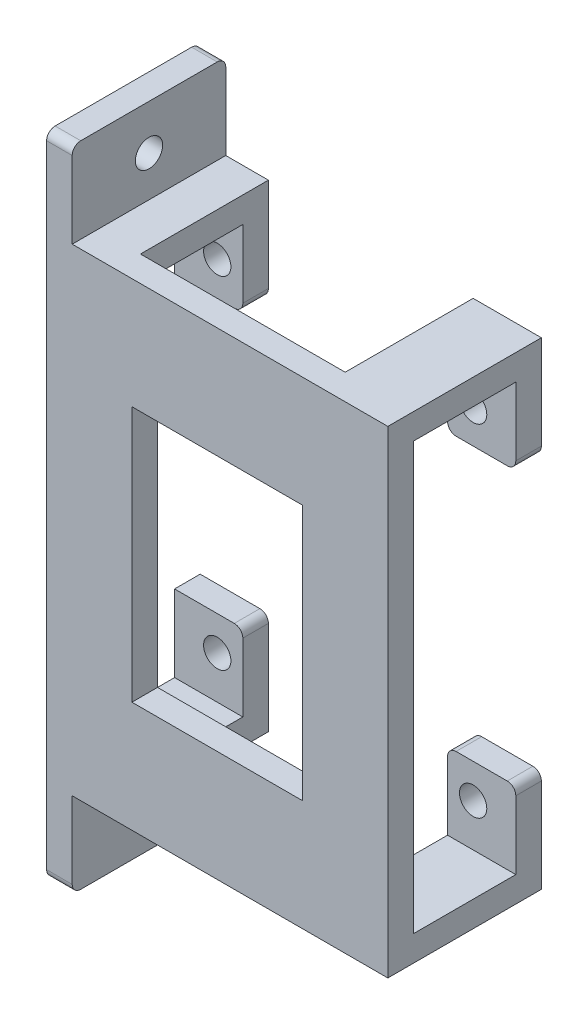
from build123d import *

# Parameters (mm, degrees)
SKETCH_1_W          = 40
SKETCH_1_H          = 50
SKETCH_1_R          = 1.6
EXTRUDE_1_DEPTH     = 3
SKETCH_2_W          = 8
SKETCH_2_H          = 3
EXTRUDE_2_DEPTH     = 15
SKETCH_3_W          = 40
SKETCH_3_H          = 56
EXTRUDE_3_DEPTH     = 3
CUT_EXTRUDE_1_REACH = 40.833
SKETCH_4_W          = 40
SKETCH_4_H          = 32
CUT_EXTRUDE_START   = -3
SKETCH_5_W          = 24
SKETCH_5_H          = 50
CUT_EXTRUDE_2_DEPTH = 3
FILLET_1_R          = 1
CUT_EXTRUDE_4_REACH = 39.537
SKETCH_10_W         = 20
SKETCH_10_H         = 30
SKETCH_11_W         = 3
SKETCH_11_H         = 18
EXTRUDE_4_DEPTH     = 10
CUT_EXTRUDE_5_REACH = 58.009
SKETCH_12_R         = 1.6
FILLET_2_R          = 1


with BuildPart() as part:
    # 草图1 → 凸台-拉伸1 (new body)
    with BuildSketch(Plane.XY):
        Rectangle(SKETCH_1_W, SKETCH_1_H)
        with Locations((-15, 20)):
            Circle(SKETCH_1_R, mode=Mode.SUBTRACT)
        with Locations((15, 20)):
            Circle(SKETCH_1_R, mode=Mode.SUBTRACT)
        with Locations((15, -20)):
            Circle(SKETCH_1_R, mode=Mode.SUBTRACT)
        with Locations((-15, -20)):
            Circle(SKETCH_1_R, mode=Mode.SUBTRACT)
    extrude(amount=EXTRUDE_1_DEPTH)

    # 草图2 → 凸台-拉伸2 (add)
    with BuildSketch(Plane(origin=(0, 0, 0), x_dir=(-1, 0, 0), z_dir=(0, 0, -1))):
        with Locations((-16, 26.5)):
            Rectangle(SKETCH_2_W, SKETCH_2_H)
        with Locations((16, 26.5)):
            Rectangle(SKETCH_2_W, SKETCH_2_H)
        with Locations((-16, -26.5)):
            Rectangle(SKETCH_2_W, SKETCH_2_H)
        with Locations((16, -26.5)):
            Rectangle(SKETCH_2_W, SKETCH_2_H)
    extrude(amount=-EXTRUDE_2_DEPTH)

    # 草图3 → 凸台-拉伸3 (add)
    with BuildSketch(Plane.XY.offset(15)):
        Rectangle(SKETCH_3_W, SKETCH_3_H)
    extrude(amount=EXTRUDE_3_DEPTH)

    # 草图4 → 切除-拉伸1 (cut, up to next)
    with BuildSketch(Plane(origin=(0, 0, 0), x_dir=(-1, 0, 0), z_dir=(0, 0, -1)), mode=Mode.PRIVATE) as cut_extrude_1_sk1:
        Rectangle(SKETCH_4_W, SKETCH_4_H)
    cut_extrude_1_tool1 = extrude(cut_extrude_1_sk1.sketch, amount=-CUT_EXTRUDE_1_REACH, mode=Mode.PRIVATE) & part.part
    add(cut_extrude_1_tool1.solids().sort_by_distance((0, 0, 0))[0], mode=Mode.SUBTRACT)

    # 草图5 → 切除-拉伸2 (cut)
    with BuildSketch(Plane(origin=(0, 0, 0), x_dir=(-1, 0, 0), z_dir=(0, 0, -1)).offset(CUT_EXTRUDE_START)):
        Rectangle(SKETCH_5_W, SKETCH_5_H)
    extrude(amount=CUT_EXTRUDE_2_DEPTH, mode=Mode.SUBTRACT)

    # 圆角1
    fillet_1_edges = [part.edges().sort_by_distance(p)[0] for p in [
        (20, -16, 1.5),
        (20, 16, 1.5),
        (12, 16, 1.5),
        (-12, 16, 1.5),
        (12, -16, 1.5),
        (-12, -16, 1.5),
    ]]
    fillet(fillet_1_edges, radius=FILLET_1_R)

    # 草图10 → 切除-拉伸4 (cut, up to next)
    with BuildSketch(Plane(origin=(0, 0, 15), x_dir=(-1, 0, 0), z_dir=(0, 0, -1)), mode=Mode.PRIVATE) as cut_extrude_4_sk1:
        Rectangle(SKETCH_10_W, SKETCH_10_H)
    cut_extrude_4_tool1 = extrude(cut_extrude_4_sk1.sketch, amount=-CUT_EXTRUDE_4_REACH, mode=Mode.PRIVATE) & part.part
    add(cut_extrude_4_tool1.solids().sort_by_distance((0, 0, 15))[0], mode=Mode.SUBTRACT)

    # 草图11 → 凸台-拉伸4 (add)
    with BuildSketch(Plane(origin=(0, 28, 0), x_dir=(1, 0, 0), z_dir=(0, 1, 0))):
        with Locations((-18.5, -9)):
            Rectangle(SKETCH_11_W, SKETCH_11_H)
    extrude_4 = extrude(amount=EXTRUDE_4_DEPTH)

    # 镜向1: 凸台-拉伸4 across plane
    add(extrude_4.mirror(Plane.ZX))

    # 草图12 → 切除-拉伸5 (cut, up to next)
    with BuildSketch(Plane(origin=(-17, 0, 0), x_dir=(0, 0, -1), z_dir=(1, 0, 0)), mode=Mode.PRIVATE) as cut_extrude_5_sk1:
        with Locations((-9, 32.75)):
            Circle(SKETCH_12_R)
    cut_extrude_5_tool1 = extrude(cut_extrude_5_sk1.sketch, amount=-CUT_EXTRUDE_5_REACH, mode=Mode.PRIVATE) & part.part
    # 草图12 → 切除-拉伸5 (cut, up to next)
    with BuildSketch(Plane(origin=(-17, 0, 0), x_dir=(0, 0, -1), z_dir=(1, 0, 0)), mode=Mode.PRIVATE) as cut_extrude_5_sk2:
        with Locations((-9, -32.75)):
            Circle(SKETCH_12_R)
    cut_extrude_5_tool2 = extrude(cut_extrude_5_sk2.sketch, amount=-CUT_EXTRUDE_5_REACH, mode=Mode.PRIVATE) & part.part
    add(cut_extrude_5_tool1.solids().sort_by_distance((-17, 32.75, 9))[0], mode=Mode.SUBTRACT)
    add(cut_extrude_5_tool2.solids().sort_by_distance((-17, -32.75, 9))[0], mode=Mode.SUBTRACT)

    # 圆角2
    fillet_2_edges = [part.edges().sort_by_distance(p)[0] for p in [
        (-18.5, 38, 18),
        (-18.5, 38, 0),
        (-18.5, -38, 0),
        (-18.5, -38, 18),
    ]]
    fillet(fillet_2_edges, radius=FILLET_2_R)


solid = part.part
